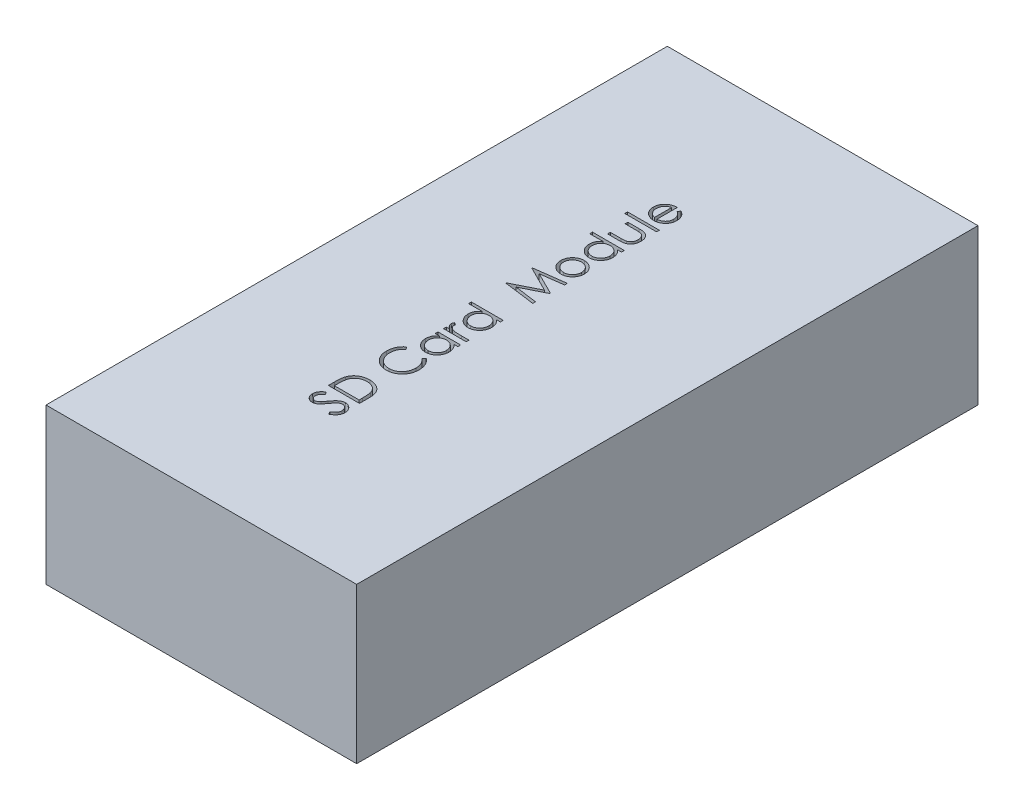
from build123d import *

# Parameters (mm, degrees)
SKETCH1_W           = 20
SKETCH1_H           = 40
BOSS_EXTRUDE1_DEPTH = 10
SKETCH2_W           = 2.051282051
SKETCH2_H           = 0.179487179
CUT_EXTRUDE1_DEPTH  = 2


with BuildPart() as part:
    # Sketch1 → Boss-Extrude1 (new body)
    with BuildSketch(Plane(origin=(0, 0, 0), x_dir=(1, 0, 0), z_dir=(0, 1, 0))):
        Rectangle(SKETCH1_W, SKETCH1_H)
    extrude(amount=BOSS_EXTRUDE1_DEPTH)

    # Sketch2 → Cut-Extrude1 (cut)
    # profile 1 of 12: a face of its own
    with BuildSketch(Plane(origin=(0, 10, 0), x_dir=(1, 0, 0), z_dir=(0, 1, 0))):
        with BuildLine():
            Line((-0.385817308, -11.41025641), (-0.487179487, -11.241185897))
            add(Edge.make_bspline(
                [(-0.487179487, -11.241185897), (-0.460856981, -11.22546119), (-0.410424076, -11.195333259), (-0.342276625, -11.145075339), (-0.284355392, -11.09299939), (-0.236997331, -11.038719771), (-0.199712253, -10.9825678), (-0.173310977, -10.924176913), (-0.156844706, -10.863743878), (-0.154844656, -10.82261598), (-0.153846154, -10.802083333)],
                knots=[0, 0, 0, 0, 1.272034388, 2.437168799, 3.508375237, 4.49857839, 5.41946034, 6.295179144, 7.148887113, 8, 8, 8, 8], degree=3))
            add(Edge.make_bspline(
                [(-0.153846154, -10.802083333), (-0.154346157, -10.784551534), (-0.155337415, -10.749794702), (-0.164477301, -10.69852676), (-0.179430136, -10.648984468), (-0.199700323, -10.601660309), (-0.22461679, -10.557808062), (-0.253997981, -10.51873726), (-0.287946895, -10.48574611), (-0.325205885, -10.458396047), (-0.365160019, -10.437232767), (-0.406327078, -10.421237355), (-0.449271907, -10.412279063), (-0.478193329, -10.410934793), (-0.492788462, -10.41025641)],
                knots=[0, 0, 0, 0, 1.09553864, 2.171907928, 3.244545276, 4.325730702, 5.384330216, 6.391480148, 7.371786628, 8.333890167, 9.27165687, 10.191402356, 11.087295184, 12, 12, 12, 12], degree=3))
            add(Edge.make_bspline(
                [(-0.492788462, -10.41025641), (-0.509445934, -10.411080779), (-0.543179131, -10.412750216), (-0.593033655, -10.427463076), (-0.642583519, -10.449928997), (-0.673239075, -10.471044437), (-0.689102564, -10.481971154)],
                knots=[0, 0, 0, 0, 0.938992559, 1.901562324, 2.914110574, 4, 4, 4, 4], degree=3))
            add(Edge.make_bspline(
                [(-0.689102564, -10.481971154), (-0.70055934, -10.490924478), (-0.724611408, -10.509720861), (-0.760383255, -10.54206249), (-0.797356653, -10.579819979), (-0.836343296, -10.622476558), (-0.877019368, -10.67010378), (-0.919702283, -10.722720072), (-0.963519813, -10.780774483), (-0.992869081, -10.821522679), (-1.008012821, -10.842548077)],
                knots=[0, 0, 0, 0, 0.72225051, 1.516274602, 2.393638633, 3.3469932, 4.386926276, 5.505032946, 6.712638081, 8, 8, 8, 8], degree=3))
            add(Edge.make_bspline(
                [(-1.008012821, -10.842548077), (-1.023000585, -10.86359036), (-1.051656049, -10.903821604), (-1.094184211, -10.960083651), (-1.133066422, -11.010394773), (-1.168668715, -11.054531354), (-1.200995918, -11.092473981), (-1.229737597, -11.124521644), (-1.255671061, -11.149857962), (-1.272494685, -11.163946866), (-1.280048077, -11.170272436)],
                knots=[0, 0, 0, 0, 1.452282411, 2.77665338, 3.964542531, 5.026858415, 5.96415736, 6.766646006, 7.446254459, 8, 8, 8, 8], degree=3))
            add(Edge.make_bspline(
                [(-1.280048077, -11.170272436), (-1.291820682, -11.179112408), (-1.314973091, -11.196497401), (-1.351150397, -11.219470521), (-1.388113303, -11.238843816), (-1.425995771, -11.254435696), (-1.464513093, -11.267044259), (-1.50395444, -11.275810445), (-1.544052062, -11.281213737), (-1.571030271, -11.281771881), (-1.584535256, -11.282051282)],
                knots=[0, 0, 0, 0, 1.068019517, 2.100403715, 3.106014851, 4.09224787, 5.069873182, 6.043214339, 7.020455327, 8, 8, 8, 8], degree=3))
            add(Edge.make_bspline(
                [(-1.584535256, -11.282051282), (-1.605695169, -11.281305482), (-1.647562716, -11.279829821), (-1.70872259, -11.267349044), (-1.767117065, -11.247652043), (-1.822154568, -11.220048221), (-1.872452268, -11.184497811), (-1.918462891, -11.143178253), (-1.957670635, -11.09442005), (-1.991393415, -11.040441094), (-2.018061545, -10.981667323), (-2.037388031, -10.919791323), (-2.048867721, -10.855257878), (-2.050469367, -10.811477321), (-2.051282051, -10.789262821)],
                knots=[0, 0, 0, 0, 1.005248779, 1.989011071, 2.95484373, 3.928844559, 4.904706341, 5.875556129, 6.859318422, 7.868909462, 8.894684146, 9.918924798, 10.944050749, 12, 12, 12, 12], degree=3))
            add(Edge.make_bspline(
                [(-2.051282051, -10.789262821), (-2.050480202, -10.765690947), (-2.048885581, -10.718814014), (-2.034675706, -10.649970746), (-2.012060047, -10.583417824), (-1.985525953, -10.530117687), (-1.95919342, -10.48831403), (-1.9351565, -10.456465403), (-1.907541477, -10.424016155), (-1.875766183, -10.391315017), (-1.840466155, -10.358039161), (-1.801342577, -10.324341865), (-1.758748016, -10.289907778), (-1.728332715, -10.267762817), (-1.712740385, -10.256410256)],
                knots=[0, 0, 0, 0, 1.286507425, 2.558452658, 3.822738219, 5.118007103, 5.800084425, 6.519418873, 7.295692132, 8.12638276, 9.008892966, 9.945018126, 10.946518512, 12, 12, 12, 12], degree=3))
            Line((-1.712740385, -10.256410256), (-1.58974359, -10.418669872))
            add(Edge.make_bspline(
                [(-1.58974359, -10.418669872), (-1.602366429, -10.428466833), (-1.626675066, -10.44733349), (-1.660706101, -10.475988413), (-1.69183416, -10.502955442), (-1.718800194, -10.529727804), (-1.743623527, -10.554241892), (-1.764499145, -10.57845685), (-1.78208662, -10.601438219), (-1.800889972, -10.630336655), (-1.818965297, -10.666944353), (-1.834842345, -10.712515046), (-1.844261458, -10.760299234), (-1.845517822, -10.792827647), (-1.846153846, -10.809294872)],
                knots=[0, 0, 0, 0, 1.181392137, 2.275085037, 3.289537922, 4.225335853, 5.084247276, 5.86831218, 6.587234301, 7.222706459, 8.415108401, 9.595592188, 10.782789524, 12, 12, 12, 12], degree=3))
            add(Edge.make_bspline(
                [(-1.846153846, -10.809294872), (-1.845472784, -10.829960617), (-1.844159419, -10.869812561), (-1.829438063, -10.926258842), (-1.807055232, -10.977356812), (-1.774779424, -11.021155815), (-1.736300444, -11.057319972), (-1.692417877, -11.08380437), (-1.643951289, -11.099638926), (-1.610158727, -11.101577048), (-1.592948718, -11.102564103)],
                knots=[0, 0, 0, 0, 1.144248881, 2.206576175, 3.214949548, 4.222996039, 5.203671638, 6.127710127, 7.046472867, 8, 8, 8, 8], degree=3))
            add(Edge.make_bspline(
                [(-1.592948718, -11.102564103), (-1.582236044, -11.102326625), (-1.560661466, -11.101848363), (-1.528938546, -11.095736945), (-1.497382892, -11.087473805), (-1.466105561, -11.074806016), (-1.434398301, -11.05716507), (-1.401813271, -11.034023927), (-1.368069803, -11.004872014), (-1.346122678, -10.982542511), (-1.334535256, -10.970753205)],
                knots=[0, 0, 0, 0, 0.858259122, 1.72847414, 2.583651051, 3.473048463, 4.427392529, 5.488649985, 6.674082839, 8, 8, 8, 8], degree=3))
            add(Edge.make_bspline(
                [(-1.334535256, -10.970753205), (-1.330628385, -10.966375278), (-1.321346551, -10.955974325), (-1.306150962, -10.936959511), (-1.287406521, -10.91184934), (-1.264213769, -10.881299511), (-1.237310076, -10.844746733), (-1.207039441, -10.802186987), (-1.172419178, -10.754094682), (-1.148214869, -10.719967873), (-1.135416667, -10.701923077)],
                knots=[0, 0, 0, 0, 0.420754252, 0.999615792, 1.744751191, 2.668019286, 3.750313428, 4.999500688, 6.413464383, 8, 8, 8, 8], degree=3))
            add(Edge.make_bspline(
                [(-1.135416667, -10.701923077), (-1.119621593, -10.680216856), (-1.089036622, -10.638185768), (-1.043084955, -10.578381229), (-0.998142857, -10.524156905), (-0.954500246, -10.475318407), (-0.912478411, -10.43139668), (-0.87160437, -10.392834482), (-0.83214617, -10.359456846), (-0.781902311, -10.323032702), (-0.719623207, -10.286255114), (-0.643285165, -10.254721355), (-0.566728056, -10.234660118), (-0.515338968, -10.232054716), (-0.489983974, -10.230769231)],
                knots=[0, 0, 0, 0, 1.163604038, 2.253157948, 3.268574773, 4.215621239, 5.091738613, 5.902582348, 6.650434646, 7.330118262, 8.591011492, 9.77460283, 10.902005569, 12, 12, 12, 12], degree=3))
            add(Edge.make_bspline(
                [(-0.489983974, -10.230769231), (-0.47205367, -10.231145121), (-0.436541256, -10.231889602), (-0.384392735, -10.24043313), (-0.333756796, -10.252979351), (-0.285309419, -10.271736996), (-0.238273251, -10.295004727), (-0.193534363, -10.324105959), (-0.150223574, -10.358014402), (-0.109555112, -10.396891472), (-0.072175555, -10.439410141), (-0.039062123, -10.484511199), (-0.0108161, -10.531723831), (0.011679088, -10.581559317), (0.029391365, -10.633482294), (0.042188861, -10.687663983), (0.050051941, -10.744159269), (0.050867437, -10.782559761), (0.051282051, -10.802083333)],
                knots=[0, 0, 0, 0, 0.983922938, 1.948738757, 2.895227473, 3.844781104, 4.796118043, 5.772795661, 6.770647148, 7.813532943, 8.8582745, 9.876489951, 10.882905461, 11.874265028, 12.874055871, 13.891769171, 14.928133632, 16, 16, 16, 16], degree=3))
            add(Edge.make_bspline(
                [(0.051282051, -10.802083333), (0.050989947, -10.817189244), (0.050409419, -10.847210821), (0.045277259, -10.891616239), (0.038016055, -10.935124574), (0.026488022, -10.977189886), (0.012501152, -11.018354091), (-0.004720655, -11.058438339), (-0.025359425, -11.097461365), (-0.048955162, -11.135644506), (-0.076422255, -11.172880415), (-0.108385085, -11.208860215), (-0.144028609, -11.244530435), (-0.183903457, -11.279638042), (-0.228448117, -11.313417099), (-0.276999076, -11.346678532), (-0.329700714, -11.379260244), (-0.366762397, -11.399731374), (-0.385817308, -11.41025641)],
                knots=[0, 0, 0, 0, 0.915313873, 1.819100311, 2.706792138, 3.586475221, 4.459428225, 5.3405999, 6.2277379, 7.133009489, 8.059106158, 9.028520402, 10.047404263, 11.114294124, 12.246039232, 13.433834781, 14.680630578, 16, 16, 16, 16], degree=3))
        make_face()
    # profile 2 of 12: a face of its own
    with BuildSketch(Plane(origin=(0, 10, 0), x_dir=(1, 0, 0), z_dir=(0, 1, 0))):
        with BuildLine():
            Line((0, -9.820512821), (-2, -9.820512821))
            Line((-2, -9.820512821), (-2, -9.416666667))
            add(Edge.make_bspline(
                [(-2, -9.416666667), (-1.999747103, -9.381541531), (-1.999258507, -9.31367995), (-1.996160569, -9.215615695), (-1.990680303, -9.124882116), (-1.982697717, -9.041777625), (-1.972895983, -8.966074076), (-1.960610038, -8.897983442), (-1.946102512, -8.837153646), (-1.933733683, -8.799742537), (-1.927884615, -8.782051282)],
                knots=[0, 0, 0, 0, 1.314313732, 2.53924729, 3.670748893, 4.714932338, 5.66265055, 6.526160246, 7.303039223, 8, 8, 8, 8], degree=3))
            add(Edge.make_bspline(
                [(-1.927884615, -8.782051282), (-1.919069815, -8.758909347), (-1.901640105, -8.713150259), (-1.868710928, -8.648033586), (-1.831553985, -8.586524618), (-1.789314193, -8.529113761), (-1.742543133, -8.475656964), (-1.691574936, -8.425547508), (-1.635277366, -8.380020843), (-1.574652486, -8.33836789), (-1.510477072, -8.300802212), (-1.442856226, -8.268151925), (-1.372138034, -8.241035177), (-1.298517891, -8.218524811), (-1.221834263, -8.200783965), (-1.141997764, -8.188680008), (-1.059323942, -8.180696584), (-1.003224249, -8.179894269), (-0.974759615, -8.179487179)],
                knots=[0, 0, 0, 0, 0.984741985, 1.947153288, 2.898543998, 3.841229145, 4.778974371, 5.722123648, 6.681464302, 7.655713756, 8.646344578, 9.637374342, 10.639946623, 11.656849581, 12.698333139, 13.76849723, 14.867749466, 16, 16, 16, 16], degree=3))
            add(Edge.make_bspline(
                [(-0.974759615, -8.179487179), (-0.950038908, -8.17984659), (-0.901324172, -8.180554845), (-0.829529371, -8.18691445), (-0.759864485, -8.196158076), (-0.692661185, -8.210468994), (-0.62733093, -8.22784205), (-0.564569078, -8.250106577), (-0.503803275, -8.27561515), (-0.445842752, -8.305348466), (-0.390965868, -8.338035097), (-0.339195829, -8.372894408), (-0.291681428, -8.410716981), (-0.247177572, -8.450383383), (-0.206873133, -8.492850164), (-0.170033415, -8.537600297), (-0.137275193, -8.584807692), (-0.108083705, -8.634764578), (-0.081978565, -8.68813814), (-0.060203746, -8.746607248), (-0.041344529, -8.809894945), (-0.026342022, -8.878362145), (-0.014242392, -8.951764646), (-0.006186412, -9.030306069), (-0.000722936, -9.113837981), (-0.000245658, -9.171197759), (0, -9.200721154)],
                knots=[0, 0, 0, 0, 1.106010661, 2.179509527, 3.223302912, 4.248870533, 5.252098245, 6.246278179, 7.226402005, 8.199283979, 9.158616973, 10.083547221, 10.989831858, 11.874256832, 12.749262829, 13.607058236, 14.46581075, 15.317568432, 16.194266721, 17.121067875, 18.106207572, 19.147242834, 20.255495536, 21.43354536, 22.679031616, 24, 24, 24, 24], degree=3))
            Line((0, -9.200721154), (0, -9.820512821))
        make_face()
        with BuildLine():
            Line((-0.205128205, -9.641025641), (-0.205128205, -9.411458333))
            add(Edge.make_bspline(
                [(-0.205128205, -9.411458333), (-0.205269974, -9.378470693), (-0.205542649, -9.31502338), (-0.207935336, -9.223790238), (-0.211845015, -9.140430583), (-0.217316488, -9.064932578), (-0.224555697, -8.99733885), (-0.23262707, -8.937508135), (-0.242682756, -8.885636559), (-0.25179759, -8.854248309), (-0.256009615, -8.83974359)],
                knots=[0, 0, 0, 0, 1.375205317, 2.645023457, 3.804390687, 4.853969522, 5.800190428, 6.637939096, 7.370582563, 8, 8, 8, 8], degree=3))
            add(Edge.make_bspline(
                [(-0.256009615, -8.83974359), (-0.262439076, -8.821487381), (-0.27514443, -8.785411013), (-0.298320254, -8.733478991), (-0.325772801, -8.685046316), (-0.35628862, -8.639269529), (-0.390942606, -8.596795773), (-0.428986447, -8.557130034), (-0.470593957, -8.520320874), (-0.515697668, -8.486935253), (-0.563808484, -8.456695563), (-0.615011493, -8.430736058), (-0.668586858, -8.40812873), (-0.724968301, -8.390227821), (-0.783742578, -8.376113738), (-0.845214457, -8.366220555), (-0.909329543, -8.360078717), (-0.952977429, -8.359346492), (-0.975160256, -8.358974359)],
                knots=[0, 0, 0, 0, 0.998590647, 1.973329978, 2.929871262, 3.868367705, 4.809062953, 5.754642869, 6.701828697, 7.672172887, 8.647399344, 9.630604387, 10.631475358, 11.644913558, 12.679592956, 13.747988925, 14.855477812, 16, 16, 16, 16], degree=3))
            add(Edge.make_bspline(
                [(-0.975160256, -8.358974359), (-0.998550817, -8.359267666), (-1.044501779, -8.35984387), (-1.111925034, -8.367086333), (-1.17677112, -8.377670079), (-1.239044374, -8.392975043), (-1.29886629, -8.412478402), (-1.35590601, -8.436818198), (-1.410765935, -8.464627694), (-1.462179858, -8.497715315), (-1.510804492, -8.533952797), (-1.555350158, -8.574168728), (-1.595918329, -8.617724179), (-1.633140794, -8.664144093), (-1.665520037, -8.714736721), (-1.694483855, -8.768310259), (-1.719064364, -8.825650642), (-1.732138, -8.865543611), (-1.738782051, -8.885817308)],
                knots=[0, 0, 0, 0, 1.122418816, 2.205001699, 3.251619955, 4.274784885, 5.280384055, 6.268708349, 7.249350384, 8.229342522, 9.199999885, 10.157847722, 11.105861043, 12.055065948, 13.010012805, 13.98527497, 14.976112212, 16, 16, 16, 16], degree=3))
            add(Edge.make_bspline(
                [(-1.738782051, -8.885817308), (-1.74342001, -8.902589391), (-1.753281583, -8.938251443), (-1.764038939, -8.996445422), (-1.773527224, -9.061939793), (-1.781560389, -9.135025337), (-1.787324573, -9.215618742), (-1.791651038, -9.303781992), (-1.794569114, -9.399553195), (-1.794768375, -9.465943214), (-1.794871795, -9.500400641)],
                knots=[0, 0, 0, 0, 0.674548936, 1.434276114, 2.292660221, 3.240891867, 4.284742987, 5.42552168, 6.663806718, 8, 8, 8, 8], degree=3))
            Line((-1.794871795, -9.500400641), (-1.794871795, -9.641025641))
            Line((-1.794871795, -9.641025641), (-0.205128205, -9.641025641))
        make_face(mode=Mode.SUBTRACT)
    # profile 3 of 12: a face of its own
    with BuildSketch(Plane(origin=(0, 10, 0), x_dir=(1, 0, 0), z_dir=(0, 1, 0))):
        with BuildLine():
            Line((-1.633012821, -5.153846154), (-1.512820513, -5.310897436))
            add(Edge.make_bspline(
                [(-1.512820513, -5.310897436), (-1.526172319, -5.322100916), (-1.55269592, -5.344356828), (-1.589943969, -5.380160398), (-1.624828696, -5.417481937), (-1.65757424, -5.456269515), (-1.686864489, -5.497420768), (-1.714980593, -5.539367716), (-1.73959721, -5.583634478), (-1.769669486, -5.644536114), (-1.800365682, -5.72451649), (-1.826767059, -5.824850686), (-1.843415161, -5.929734011), (-1.845230494, -6.001272761), (-1.846153846, -6.037660256)],
                knots=[0, 0, 0, 0, 0.75789156, 1.505565099, 2.245254514, 2.979266606, 3.711207489, 4.440978832, 5.174393176, 5.91211879, 7.394186119, 8.890401545, 10.418332761, 12, 12, 12, 12], degree=3))
            add(Edge.make_bspline(
                [(-1.846153846, -6.037660256), (-1.84592301, -6.057707856), (-1.845463481, -6.097616995), (-1.839401124, -6.156844694), (-1.830880433, -6.214966437), (-1.818237391, -6.271944418), (-1.802253037, -6.327706109), (-1.783152799, -6.382616051), (-1.759521469, -6.43587926), (-1.733402437, -6.488232504), (-1.703901136, -6.538392182), (-1.67172173, -6.585851741), (-1.637226373, -6.630440861), (-1.600278221, -6.672184646), (-1.561071448, -6.711163213), (-1.519166808, -6.746886072), (-1.475012276, -6.779830509), (-1.428571182, -6.809808768), (-1.380276055, -6.836796162), (-1.329851157, -6.859488364), (-1.278159866, -6.879307579), (-1.224835727, -6.895237086), (-1.170233159, -6.90774762), (-1.114125959, -6.916396828), (-1.056620504, -6.922388926), (-1.017643821, -6.922846349), (-0.997996795, -6.923076923)],
                knots=[0, 0, 0, 0, 1.054877232, 2.099964208, 3.13098259, 4.145888998, 5.169474743, 6.183358035, 7.203388855, 8.234598956, 9.261847606, 10.264062591, 11.251197969, 12.227332808, 13.196685059, 14.158975844, 15.123498106, 16.094582253, 17.066912473, 18.032714859, 19.002806091, 19.979168736, 20.95977404, 21.949109834, 22.966205168, 24, 24, 24, 24], degree=3))
            add(Edge.make_bspline(
                [(-0.997996795, -6.923076923), (-0.9684367, -6.922354193), (-0.910399373, -6.920935208), (-0.825378242, -6.908360161), (-0.743849751, -6.889097652), (-0.666365924, -6.860701057), (-0.592280839, -6.824987833), (-0.52249293, -6.780427578), (-0.455979782, -6.728623667), (-0.394352306, -6.669044658), (-0.338059544, -6.603668177), (-0.288487573, -6.533526972), (-0.247164838, -6.458792972), (-0.212778568, -6.380292073), (-0.186346157, -6.297419999), (-0.167738085, -6.210325829), (-0.155599696, -6.119198973), (-0.154437589, -6.056930745), (-0.153846154, -6.025240385)],
                knots=[0, 0, 0, 0, 1.029159485, 2.020618137, 2.987588728, 3.942669054, 4.889339625, 5.846988364, 6.821327795, 7.821533711, 8.827683044, 9.822769455, 10.807800696, 11.797391277, 12.803701919, 13.832062008, 14.896664671, 16, 16, 16, 16], degree=3))
            add(Edge.make_bspline(
                [(-0.153846154, -6.025240385), (-0.154811171, -5.990324562), (-0.156710555, -5.921601872), (-0.172801555, -5.820820142), (-0.198891793, -5.724342562), (-0.235404892, -5.632163941), (-0.282870771, -5.544544143), (-0.340412415, -5.461346052), (-0.408577176, -5.38249944), (-0.460624678, -5.335087279), (-0.487179487, -5.310897436)],
                knots=[0, 0, 0, 0, 1.028121516, 2.023589091, 2.998037872, 3.967518031, 4.937445131, 5.927275754, 6.942489185, 8, 8, 8, 8], degree=3))
            Line((-0.487179487, -5.310897436), (-0.368189103, -5.153846154))
            add(Edge.make_bspline(
                [(-0.368189103, -5.153846154), (-0.35188198, -5.166485517), (-0.319345845, -5.191703701), (-0.273467927, -5.232530281), (-0.230354032, -5.275570433), (-0.190219472, -5.320934789), (-0.152898122, -5.368703305), (-0.118369709, -5.418871599), (-0.086817476, -5.471396847), (-0.057835201, -5.525861847), (-0.03231729, -5.582392102), (-0.009704694, -5.640489953), (0.009016038, -5.700511621), (0.024851677, -5.761951857), (0.0361432, -5.825365554), (0.045134885, -5.890015574), (0.050469418, -5.956507019), (0.051008744, -6.001326042), (0.051282051, -6.024038462)],
                knots=[0, 0, 0, 0, 0.986911346, 1.969095443, 2.935967484, 3.900112155, 4.865124501, 5.834589912, 6.812044781, 7.795288262, 8.784678562, 9.777857908, 10.776141921, 11.791195789, 12.811324908, 13.855933174, 14.913475973, 16, 16, 16, 16], degree=3))
            add(Edge.make_bspline(
                [(0.051282051, -6.024038462), (0.051132341, -6.045549128), (0.050836308, -6.088083808), (0.046040784, -6.150883095), (0.039498077, -6.212019998), (0.029646574, -6.271319785), (0.018021237, -6.329106056), (0.002437661, -6.384854962), (-0.015019005, -6.439115082), (-0.035536141, -6.491668419), (-0.058688245, -6.542559676), (-0.08485485, -6.591624711), (-0.113815916, -6.638840958), (-0.144933064, -6.684672628), (-0.179205808, -6.728442675), (-0.216158171, -6.770530404), (-0.255665606, -6.811171819), (-0.284154093, -6.836316211), (-0.298477564, -6.848958333)],
                knots=[0, 0, 0, 0, 1.114604814, 2.203992996, 3.262667896, 4.300477797, 5.318619304, 6.316056647, 7.298880507, 8.271930387, 9.238335007, 10.195173496, 11.151986948, 12.108099108, 13.064862484, 14.031167946, 15.010108607, 16, 16, 16, 16], degree=3))
            add(Edge.make_bspline(
                [(-0.298477564, -6.848958333), (-0.323358757, -6.869205952), (-0.372820755, -6.909456742), (-0.452976615, -6.960976578), (-0.536591603, -7.004930243), (-0.62415003, -7.04086511), (-0.715685935, -7.06846728), (-0.811052064, -7.0878734), (-0.910057774, -7.100396139), (-0.977392133, -7.101833489), (-1.01161859, -7.102564103)],
                knots=[0, 0, 0, 0, 0.994611881, 1.977215934, 2.950189954, 3.921972279, 4.908960509, 5.911694611, 6.938501887, 8, 8, 8, 8], degree=3))
            add(Edge.make_bspline(
                [(-1.01161859, -7.102564103), (-1.047593135, -7.101675421), (-1.118370806, -7.099926994), (-1.222241636, -7.085072254), (-1.321756721, -7.061175799), (-1.41673029, -7.02723472), (-1.507661878, -6.98420309), (-1.593856853, -6.931045025), (-1.675866452, -6.868378087), (-1.75244631, -6.796693763), (-1.822468797, -6.718083857), (-1.884072342, -6.633901677), (-1.935339494, -6.544311993), (-1.978194444, -6.450301792), (-2.011134138, -6.351167117), (-2.034193101, -6.247119478), (-2.048545739, -6.138354383), (-2.050360144, -6.064147283), (-2.051282051, -6.026442308)],
                knots=[0, 0, 0, 0, 1.032925535, 2.032216505, 3.007276963, 3.968222605, 4.92396291, 5.891752235, 6.871517503, 7.883894988, 8.900124299, 9.891468569, 10.874487609, 11.85992873, 12.854644235, 13.869047385, 14.917252991, 16, 16, 16, 16], degree=3))
            add(Edge.make_bspline(
                [(-2.051282051, -6.026442308), (-2.051006304, -6.003462685), (-2.05046049, -5.957976836), (-2.045146168, -5.890688513), (-2.036268482, -5.825182629), (-2.024248677, -5.76139029), (-2.009112159, -5.699127068), (-1.990247208, -5.638509449), (-1.967787158, -5.579685868), (-1.942138823, -5.522675436), (-1.913297416, -5.467863005), (-1.881603132, -5.415282985), (-1.847216112, -5.365144998), (-1.809784311, -5.31770964), (-1.769618223, -5.272918875), (-1.727188337, -5.230108273), (-1.681405869, -5.190524011), (-1.649173365, -5.166094486), (-1.633012821, -5.153846154)],
                knots=[0, 0, 0, 0, 1.096622143, 2.170653093, 3.219033441, 4.250379162, 5.267604342, 6.275621678, 7.278284436, 8.271072515, 9.257558938, 10.232633088, 11.19973724, 12.157384997, 13.114417402, 14.069920322, 15.032307892, 16, 16, 16, 16], degree=3))
        make_face()
    # profile 4 of 12: a face of its own
    with BuildSketch(Plane(origin=(0, 10, 0), x_dir=(1, 0, 0), z_dir=(0, 1, 0))):
        with BuildLine():
            Line((-1.461538462, -3.307692308), (0, -3.307692308))
            Line((0, -3.307692308), (0, -3.487179487))
            Line((0, -3.487179487), (-0.252804487, -3.487179487))
            add(Edge.make_bspline(
                [(-0.252804487, -3.487179487), (-0.229962419, -3.507450393), (-0.185319545, -3.547068149), (-0.126461954, -3.612613758), (-0.078803458, -3.682955799), (-0.039753095, -3.756329182), (-0.010538305, -3.83345262), (0.010263999, -3.913923011), (0.023629123, -3.997817237), (0.024964375, -4.055104021), (0.025641026, -4.084134615)],
                knots=[0, 0, 0, 0, 1.074325654, 2.099677833, 3.090439787, 4.057542011, 5.018572219, 5.985274637, 6.979019747, 8, 8, 8, 8], degree=3))
            add(Edge.make_bspline(
                [(0.025641026, -4.084134615), (0.024940241, -4.109944875), (0.023558264, -4.160843849), (0.012836948, -4.235717607), (-0.00438055, -4.307770321), (-0.028323916, -4.377070077), (-0.060084385, -4.443168446), (-0.098107956, -4.506631358), (-0.14338843, -4.567130039), (-0.195153018, -4.623742347), (-0.251378724, -4.675874919), (-0.311347608, -4.721624218), (-0.374800354, -4.759768835), (-0.440933584, -4.791666024), (-0.510256395, -4.816235363), (-0.582529063, -4.833363154), (-0.657666133, -4.844071981), (-0.708831575, -4.845453387), (-0.734775641, -4.846153846)],
                knots=[0, 0, 0, 0, 1.033919861, 2.038935746, 3.024066025, 3.998881131, 4.97069526, 5.957263378, 6.95902576, 7.993208707, 9.027059324, 10.027763471, 11.009749337, 11.988697705, 12.965288445, 13.950418724, 14.960734635, 16, 16, 16, 16], degree=3))
            add(Edge.make_bspline(
                [(-0.734775641, -4.846153846), (-0.760183472, -4.845437863), (-0.810413382, -4.844022401), (-0.884286924, -4.833477704), (-0.955440216, -4.815745699), (-1.023644183, -4.790861215), (-1.088981355, -4.758951527), (-1.15149794, -4.720135477), (-1.211366168, -4.674410263), (-1.267178297, -4.621694602), (-1.318732934, -4.564589019), (-1.363538103, -4.503498315), (-1.402233445, -4.439942154), (-1.432892574, -4.37293472), (-1.457697777, -4.303467803), (-1.474859473, -4.230922977), (-1.484972228, -4.155602075), (-1.486436665, -4.104464651), (-1.487179487, -4.078525641)],
                knots=[0, 0, 0, 0, 1.020392517, 2.01726096, 2.990465484, 3.961182959, 4.928053699, 5.906110375, 6.912531644, 7.948652711, 8.985773172, 9.998621852, 10.987621588, 11.969261332, 12.953316658, 13.946091881, 14.958173133, 16, 16, 16, 16], degree=3))
            add(Edge.make_bspline(
                [(-1.487179487, -4.078525641), (-1.486357, -4.048697715), (-1.484744141, -3.99020656), (-1.471349807, -3.90463971), (-1.448652067, -3.823729139), (-1.417990195, -3.746615902), (-1.376392304, -3.674361445), (-1.325386481, -3.606066305), (-1.262863963, -3.543183468), (-1.21543894, -3.506170412), (-1.191105769, -3.487179487)],
                knots=[0, 0, 0, 0, 1.039007978, 2.037445607, 3.008437381, 3.96246474, 4.921201921, 5.904967172, 6.925065498, 8, 8, 8, 8], degree=3))
            Line((-1.191105769, -3.487179487), (-1.461538462, -3.487179487))
            Line((-1.461538462, -3.487179487), (-1.461538462, -3.307692308))
        make_face()
        with BuildLine():
            add(Edge.make_bspline(
                [(-1.307692308, -4.076121795), (-1.306758001, -4.102357995), (-1.30491383, -4.15414408), (-1.290540529, -4.23017739), (-1.266563058, -4.302897228), (-1.233962877, -4.372190515), (-1.192192741, -4.436124962), (-1.142979808, -4.494267497), (-1.085493382, -4.54482536), (-1.021790739, -4.588304999), (-0.953120856, -4.623209426), (-0.88136033, -4.647909008), (-0.807751066, -4.664168706), (-0.757830388, -4.665831845), (-0.732772436, -4.666666667)],
                knots=[0, 0, 0, 0, 1.031130969, 2.035288524, 3.029955243, 4.035265425, 5.037320146, 6.024362013, 7.021230137, 8.037832003, 9.049975902, 10.039737725, 11.016035826, 12, 12, 12, 12], degree=3))
            add(Edge.make_bspline(
                [(-0.732772436, -4.666666667), (-0.707865376, -4.665596713), (-0.658148885, -4.663460999), (-0.584545939, -4.648265002), (-0.512946494, -4.622436703), (-0.443724789, -4.587579474), (-0.3793997, -4.543588113), (-0.320880752, -4.493078334), (-0.270898021, -4.43465606), (-0.229027187, -4.370149998), (-0.195225603, -4.301224743), (-0.171700919, -4.228749894), (-0.156513999, -4.154077659), (-0.15473996, -4.103304956), (-0.153846154, -4.077724359)],
                knots=[0, 0, 0, 0, 0.979154007, 1.954470061, 2.941101473, 3.965068436, 4.993389179, 5.998216918, 6.996159742, 8.005560442, 9.015493761, 10.005250788, 10.994993882, 12, 12, 12, 12], degree=3))
            add(Edge.make_bspline(
                [(-0.153846154, -4.077724359), (-0.154805663, -4.051758467), (-0.156714031, -4.000114884), (-0.171006012, -3.923771097), (-0.195514187, -3.849936833), (-0.228450639, -3.779115758), (-0.269473838, -3.713204459), (-0.317500922, -3.654248673), (-0.372971978, -3.60380746), (-0.434643565, -3.56181146), (-0.501822981, -3.52850658), (-0.573274006, -3.504154477), (-0.649141668, -3.489916449), (-0.701061842, -3.488104422), (-0.727564103, -3.487179487)],
                knots=[0, 0, 0, 0, 1.01787422, 2.024450869, 3.03297362, 4.061474925, 5.080076323, 6.069755756, 7.033548292, 8.009625779, 8.9862229, 9.964937832, 10.961217871, 12, 12, 12, 12], degree=3))
            add(Edge.make_bspline(
                [(-0.727564103, -3.487179487), (-0.747757149, -3.487727862), (-0.787503453, -3.488807238), (-0.845862035, -3.497053278), (-0.901709878, -3.510170378), (-0.955105701, -3.528653904), (-1.005754281, -3.552934638), (-1.054019287, -3.582219076), (-1.099649693, -3.61702219), (-1.142017162, -3.656783731), (-1.180660855, -3.700306703), (-1.215154707, -3.746360727), (-1.243491148, -3.795491439), (-1.266943304, -3.846872603), (-1.285605675, -3.900593366), (-1.298055786, -3.957090863), (-1.306604541, -4.01576457), (-1.307325901, -4.055790887), (-1.307692308, -4.076121795)],
                knots=[0, 0, 0, 0, 1.050140795, 2.067009409, 3.05949893, 4.030605086, 5.00011959, 5.97591094, 6.962425594, 7.979863591, 8.993523472, 9.986985069, 10.967611495, 11.937549037, 12.921786183, 13.919465291, 14.943216303, 16, 16, 16, 16], degree=3))
        make_face(mode=Mode.SUBTRACT)
    # profile 5 of 12: a face of its own
    with BuildSketch(Plane(origin=(0, 10, 0), x_dir=(1, 0, 0), z_dir=(0, 1, 0))):
        with BuildLine():
            Line((-1.461538462, -2.948717949), (-1.461538462, -2.769230769))
            Line((-1.461538462, -2.769230769), (-1.246394231, -2.769230769))
            add(Edge.make_bspline(
                [(-1.246394231, -2.769230769), (-1.2664351, -2.755988528), (-1.304763108, -2.730662846), (-1.355386319, -2.688371521), (-1.397778978, -2.645514622), (-1.431132652, -2.600966804), (-1.456339885, -2.555164823), (-1.474052217, -2.508494905), (-1.485036174, -2.460842924), (-1.486464092, -2.42874266), (-1.487179487, -2.412660256)],
                knots=[0, 0, 0, 0, 1.280091057, 2.448164201, 3.510831157, 4.48793739, 5.405868014, 6.289422536, 7.142991551, 8, 8, 8, 8], degree=3))
            add(Edge.make_bspline(
                [(-1.487179487, -2.412660256), (-1.486499186, -2.40018807), (-1.485099423, -2.374525735), (-1.475264666, -2.335678541), (-1.459562939, -2.295653712), (-1.444797097, -2.269858062), (-1.437099359, -2.256410256)],
                knots=[0, 0, 0, 0, 0.901110191, 1.854092781, 2.881294221, 4, 4, 4, 4], degree=3))
            Line((-1.437099359, -2.256410256), (-1.281650641, -2.354967949))
            add(Edge.make_bspline(
                [(-1.281650641, -2.354967949), (-1.285502222, -2.363601675), (-1.292813259, -2.379990141), (-1.301465836, -2.403964178), (-1.306560645, -2.426067799), (-1.307332484, -2.440149833), (-1.307692308, -2.446714744)],
                knots=[0, 0, 0, 0, 1.180555205, 2.24091978, 3.179933427, 4, 4, 4, 4], degree=3))
            add(Edge.make_bspline(
                [(-1.307692308, -2.446714744), (-1.306739804, -2.461122344), (-1.304796974, -2.490509673), (-1.289305165, -2.533510436), (-1.264994983, -2.57561065), (-1.237312873, -2.608723926), (-1.210721786, -2.634453563), (-1.18744872, -2.652957665), (-1.161111118, -2.669565372), (-1.132726985, -2.685675289), (-1.101583961, -2.700642617), (-1.06763124, -2.714018125), (-1.031149191, -2.726526799), (-1.005782372, -2.733571107), (-0.992788462, -2.737179487)],
                knots=[0, 0, 0, 0, 1.125322384, 2.295331465, 3.535939348, 4.916963136, 5.656144286, 6.429838446, 7.238666481, 8.090384391, 8.983239461, 9.940052224, 10.944811494, 12, 12, 12, 12], degree=3))
            add(Edge.make_bspline(
                [(-0.992788462, -2.737179487), (-0.981202147, -2.739888385), (-0.955410648, -2.745918478), (-0.912337848, -2.751624988), (-0.86148149, -2.75749035), (-0.802782493, -2.761495802), (-0.736015218, -2.765279485), (-0.661467698, -2.767369748), (-0.578935039, -2.769164264), (-0.521368833, -2.769207894), (-0.491185897, -2.769230769)],
                knots=[0, 0, 0, 0, 0.566841273, 1.261806378, 2.068780918, 3.007109044, 4.065315289, 5.256255371, 6.561408263, 8, 8, 8, 8], degree=3))
            Line((-0.491185897, -2.769230769), (0, -2.769230769))
            Line((0, -2.769230769), (0, -2.948717949))
            Line((0, -2.948717949), (-1.461538462, -2.948717949))
        make_face()
    # profile 6 of 12: a face of its own
    with BuildSketch(Plane(origin=(0, 10, 0), x_dir=(1, 0, 0), z_dir=(0, 1, 0))):
        with BuildLine():
            Line((-2.051282051, -0.564102564), (0, -0.564102564))
            Line((0, -0.564102564), (0, -0.743589744))
            Line((0, -0.743589744), (-0.252804487, -0.743589744))
            add(Edge.make_bspline(
                [(-0.252804487, -0.743589744), (-0.229962419, -0.763860649), (-0.185319545, -0.803478405), (-0.126461954, -0.869024015), (-0.078803458, -0.939366055), (-0.039753095, -1.012739439), (-0.010538305, -1.089862876), (0.010263999, -1.170333268), (0.023629123, -1.254227493), (0.024964375, -1.311514277), (0.025641026, -1.340544872)],
                knots=[0, 0, 0, 0, 1.074325654, 2.099677833, 3.090439787, 4.057542011, 5.018572219, 5.985274637, 6.979019747, 8, 8, 8, 8], degree=3))
            add(Edge.make_bspline(
                [(0.025641026, -1.340544872), (0.024940241, -1.366355131), (0.023558264, -1.417254105), (0.012836948, -1.492127864), (-0.00438055, -1.564180578), (-0.028323916, -1.633480333), (-0.060084385, -1.699578702), (-0.098107956, -1.763041615), (-0.14338843, -1.823540296), (-0.195153018, -1.880152604), (-0.251378724, -1.932285175), (-0.311347608, -1.978034474), (-0.374800354, -2.016179091), (-0.440933584, -2.04807628), (-0.510256395, -2.07264562), (-0.582529063, -2.089773411), (-0.657666133, -2.100482238), (-0.708831575, -2.101863644), (-0.734775641, -2.102564103)],
                knots=[0, 0, 0, 0, 1.033919861, 2.038935746, 3.024066025, 3.998881131, 4.97069526, 5.957263378, 6.95902576, 7.993208707, 9.027059324, 10.027763471, 11.009749337, 11.988697705, 12.965288445, 13.950418724, 14.960734635, 16, 16, 16, 16], degree=3))
            add(Edge.make_bspline(
                [(-0.734775641, -2.102564103), (-0.760183472, -2.101848119), (-0.810413382, -2.100432658), (-0.884286924, -2.089887961), (-0.955440216, -2.072155956), (-1.023644183, -2.047271471), (-1.088981355, -2.015361783), (-1.15149794, -1.976545733), (-1.211366168, -1.930820519), (-1.267178297, -1.878104858), (-1.318732934, -1.820999275), (-1.363538103, -1.759908572), (-1.402233445, -1.696352411), (-1.432892574, -1.629344976), (-1.457697777, -1.559878059), (-1.474859473, -1.487333233), (-1.484972228, -1.412012331), (-1.486436665, -1.360874907), (-1.487179487, -1.334935897)],
                knots=[0, 0, 0, 0, 1.020392517, 2.01726096, 2.990465484, 3.961182959, 4.928053699, 5.906110375, 6.912531644, 7.948652711, 8.985773172, 9.998621852, 10.987621588, 11.969261332, 12.953316658, 13.946091881, 14.958173133, 16, 16, 16, 16], degree=3))
            add(Edge.make_bspline(
                [(-1.487179487, -1.334935897), (-1.48629542, -1.305094491), (-1.484560094, -1.246519126), (-1.4697153, -1.160946739), (-1.44566327, -1.07979224), (-1.411846191, -1.002882208), (-1.367460119, -0.930891066), (-1.31454749, -0.86262352), (-1.250895871, -0.799798893), (-1.203122867, -0.762611787), (-1.178685897, -0.743589744)],
                knots=[0, 0, 0, 0, 1.030935089, 2.023611011, 2.991955418, 3.950956655, 4.918431382, 5.908366361, 6.930082213, 8, 8, 8, 8], degree=3))
            Line((-1.178685897, -0.743589744), (-2.051282051, -0.743589744))
            Line((-2.051282051, -0.743589744), (-2.051282051, -0.564102564))
        make_face()
        with BuildLine():
            add(Edge.make_bspline(
                [(-1.307692308, -1.332532051), (-1.306758001, -1.358768251), (-1.30491383, -1.410554337), (-1.290540529, -1.486587646), (-1.266563058, -1.559307484), (-1.233962877, -1.628600771), (-1.192192741, -1.692535219), (-1.142979808, -1.750677754), (-1.085493382, -1.801235616), (-1.021790739, -1.844715255), (-0.953120856, -1.879619682), (-0.88136033, -1.904319265), (-0.807751066, -1.920578962), (-0.757830388, -1.922242101), (-0.732772436, -1.923076923)],
                knots=[0, 0, 0, 0, 1.031130969, 2.035288524, 3.029955243, 4.035265425, 5.037320146, 6.024362013, 7.021230137, 8.037832003, 9.049975902, 10.039737725, 11.016035826, 12, 12, 12, 12], degree=3))
            add(Edge.make_bspline(
                [(-0.732772436, -1.923076923), (-0.707865376, -1.922006969), (-0.658148885, -1.919871255), (-0.584545939, -1.904675259), (-0.512946494, -1.87884696), (-0.443724789, -1.843989731), (-0.3793997, -1.799998369), (-0.320880752, -1.749488591), (-0.270898021, -1.691066317), (-0.229027187, -1.626560254), (-0.195225603, -1.557634999), (-0.171700919, -1.48516015), (-0.156513999, -1.410487916), (-0.15473996, -1.359715213), (-0.153846154, -1.334134615)],
                knots=[0, 0, 0, 0, 0.979154007, 1.954470061, 2.941101473, 3.965068436, 4.993389179, 5.998216918, 6.996159742, 8.005560442, 9.015493761, 10.005250788, 10.994993882, 12, 12, 12, 12], degree=3))
            add(Edge.make_bspline(
                [(-0.153846154, -1.334134615), (-0.154805663, -1.308168724), (-0.156714031, -1.25652514), (-0.171006012, -1.180181353), (-0.195514187, -1.106347089), (-0.228450639, -1.035526015), (-0.269473838, -0.969614716), (-0.317500922, -0.910658929), (-0.372971978, -0.860217717), (-0.434643565, -0.818221716), (-0.501822981, -0.784916836), (-0.573274006, -0.760564733), (-0.649141668, -0.746326705), (-0.701061842, -0.744514679), (-0.727564103, -0.743589744)],
                knots=[0, 0, 0, 0, 1.01787422, 2.024450869, 3.03297362, 4.061474925, 5.080076323, 6.069755756, 7.033548292, 8.009625779, 8.9862229, 9.964937832, 10.961217871, 12, 12, 12, 12], degree=3))
            add(Edge.make_bspline(
                [(-0.727564103, -0.743589744), (-0.747757149, -0.744138119), (-0.787503453, -0.745217494), (-0.845862035, -0.753463534), (-0.901709878, -0.766580635), (-0.955105701, -0.785064161), (-1.005754281, -0.809344895), (-1.054019287, -0.838629332), (-1.099649693, -0.873432446), (-1.142017162, -0.913193987), (-1.180660855, -0.95671696), (-1.215154707, -1.002770983), (-1.243491148, -1.051901696), (-1.266943304, -1.10328286), (-1.285605675, -1.157003622), (-1.298055786, -1.213501119), (-1.306604541, -1.272174826), (-1.307325901, -1.312201143), (-1.307692308, -1.332532051)],
                knots=[0, 0, 0, 0, 1.050140795, 2.067009409, 3.05949893, 4.030605086, 5.00011959, 5.97591094, 6.962425594, 7.979863591, 8.993523472, 9.986985069, 10.967611495, 11.937549037, 12.921786183, 13.919465291, 14.943216303, 16, 16, 16, 16], degree=3))
        make_face(mode=Mode.SUBTRACT)
    # profile 7 of 12: a face of its own
    with BuildSketch(Plane(origin=(0, 10, 0), x_dir=(1, 0, 0), z_dir=(0, 1, 0))):
        Polygon((0, 1.333333333), (-2, 1.597355769), (-2, 1.622996795), (-0.358974359, 2.448717949), (-2, 3.272435897), (-2, 3.298477564), (0, 3.564102564), (0, 3.383814103), (-1.439102564, 3.192307692), (0, 2.470352564), (0, 2.429887821), (-1.442307692, 1.705128205), (0, 1.514022436), align=None)
    # profile 8 of 12: a face of its own
    with BuildSketch(Plane(origin=(0, 10, 0), x_dir=(1, 0, 0), z_dir=(0, 1, 0))):
        with BuildLine():
            add(Edge.make_bspline(
                [(-1.487179487, 4.62900641), (-1.486595549, 4.656429995), (-1.48545059, 4.710200942), (-1.473213467, 4.788948305), (-1.454500687, 4.864116954), (-1.428631223, 4.935994778), (-1.393955823, 5.003661233), (-1.352579085, 5.068101944), (-1.30356046, 5.129140235), (-1.265641564, 5.165724823), (-1.246394231, 5.184294872)],
                knots=[0, 0, 0, 0, 1.054011418, 2.066658804, 3.057071809, 4.030435133, 4.997543892, 5.974964718, 6.972108034, 8, 8, 8, 8], degree=3))
            add(Edge.make_bspline(
                [(-1.246394231, 5.184294872), (-1.227986239, 5.20028456), (-1.1915265, 5.231954491), (-1.132409007, 5.272563474), (-1.071186093, 5.307547222), (-1.007044763, 5.3355832), (-0.940544951, 5.357688928), (-0.871458088, 5.373383611), (-0.799936746, 5.382719003), (-0.751363125, 5.383977841), (-0.726762821, 5.384615385)],
                knots=[0, 0, 0, 0, 1.025258237, 2.030674902, 3.01204498, 3.988269485, 4.97094183, 5.956517959, 6.965070386, 8, 8, 8, 8], degree=3))
            add(Edge.make_bspline(
                [(-0.726762821, 5.384615385), (-0.70201993, 5.38405462), (-0.653126826, 5.382946524), (-0.581115759, 5.372464458), (-0.511290147, 5.35616098), (-0.443942322, 5.332828501), (-0.37886642, 5.302909582), (-0.316346678, 5.266400617), (-0.256259744, 5.223045407), (-0.199115837, 5.173900266), (-0.146449428, 5.119584909), (-0.10054756, 5.060661395), (-0.061220975, 4.998287662), (-0.029543023, 4.931634317), (-0.004566051, 4.861310039), (0.012976815, 4.787163143), (0.023583492, 4.709308817), (0.024945534, 4.656150405), (0.025641026, 4.62900641)],
                knots=[0, 0, 0, 0, 0.998656419, 1.973391657, 2.932242238, 3.890759089, 4.846373663, 5.82037756, 6.809684879, 7.83454468, 8.860553229, 9.859544525, 10.845671541, 11.83227036, 12.833544569, 13.85385346, 14.904124723, 16, 16, 16, 16], degree=3))
            add(Edge.make_bspline(
                [(0.025641026, 4.62900641), (0.024943199, 4.601729428), (0.023576471, 4.548306079), (0.013018024, 4.470176947), (-0.004557966, 4.395897164), (-0.029625105, 4.325480822), (-0.061221987, 4.25854091), (-0.100428667, 4.195805769), (-0.146463041, 4.136834389), (-0.199112148, 4.08250754), (-0.256260695, 4.03336548), (-0.316346431, 3.990009475), (-0.378866484, 3.953500718), (-0.443942304, 3.923581744), (-0.511290151, 3.900249279), (-0.581115758, 3.883945798), (-0.653126826, 3.873463732), (-0.702019931, 3.872355636), (-0.726762821, 3.871794872)],
                knots=[0, 0, 0, 0, 1.099876186, 2.154163076, 3.173186993, 4.173200201, 5.163417411, 6.152872554, 7.150605724, 8.17532212, 9.198891216, 10.186952605, 11.159729845, 12.11414092, 13.071450619, 14.029093627, 15.002601286, 16, 16, 16, 16], degree=3))
            add(Edge.make_bspline(
                [(-0.726762821, 3.871794872), (-0.751229964, 3.872435238), (-0.799670703, 3.873703054), (-0.871049675, 3.883051186), (-0.939925092, 3.898575099), (-1.006061762, 3.920987275), (-1.070048929, 3.94897121), (-1.13149632, 3.983602862), (-1.190355495, 4.024604668), (-1.226766883, 4.056151563), (-1.245192308, 4.072115385)],
                knots=[0, 0, 0, 0, 1.031377469, 2.041950136, 3.029500481, 4.003457997, 4.981637986, 5.969878303, 6.97268806, 8, 8, 8, 8], degree=3))
            add(Edge.make_bspline(
                [(-1.245192308, 4.072115385), (-1.264606559, 4.090657437), (-1.302788099, 4.127123645), (-1.351663827, 4.188465775), (-1.393901584, 4.252747958), (-1.427887993, 4.321162202), (-1.45465286, 4.392980978), (-1.473261726, 4.468534831), (-1.4854065, 4.547549411), (-1.486582602, 4.60158348), (-1.487179487, 4.62900641)],
                knots=[0, 0, 0, 0, 1.027980169, 2.021703884, 2.998553061, 3.971491411, 4.943284454, 5.930300938, 6.949603206, 8, 8, 8, 8], degree=3))
        make_face()
        with BuildLine():
            add(Edge.make_bspline(
                [(-1.307692308, 4.628205128), (-1.307141112, 4.608812207), (-1.306052951, 4.570526991), (-1.297776434, 4.514172943), (-1.284663575, 4.459921424), (-1.266032682, 4.407669521), (-1.241976182, 4.357593393), (-1.212428496, 4.309645277), (-1.177781293, 4.26368344), (-1.13808756, 4.220609691), (-1.094731021, 4.181070575), (-1.048521534, 4.146534725), (-1.000166932, 4.117002854), (-0.949594451, 4.092847537), (-0.896631658, 4.074322124), (-0.841590451, 4.061194664), (-0.784304626, 4.052902992), (-0.745354277, 4.051828218), (-0.725560897, 4.051282051)],
                knots=[0, 0, 0, 0, 1.02155314, 2.01673505, 2.994700672, 3.958461264, 4.934171024, 5.916582427, 6.921469794, 7.962398674, 8.998583302, 10.009097305, 10.997513862, 11.97957236, 12.956600784, 13.948243505, 14.957359924, 16, 16, 16, 16], degree=3))
            add(Edge.make_bspline(
                [(-0.725560897, 4.051282051), (-0.69998831, 4.052200236), (-0.649231507, 4.054022662), (-0.574482294, 4.068842797), (-0.502721236, 4.093634957), (-0.434369015, 4.127113402), (-0.371127714, 4.169059813), (-0.314744008, 4.218480994), (-0.266066402, 4.274846537), (-0.225677347, 4.337484537), (-0.193586058, 4.405115576), (-0.170843786, 4.476690616), (-0.156059962, 4.551342442), (-0.154590548, 4.602360002), (-0.153846154, 4.628205128)],
                knots=[0, 0, 0, 0, 1.016792936, 2.018143844, 3.017858371, 4.030088057, 5.03801393, 6.028138512, 7.003788237, 7.991172063, 8.984598303, 9.972568034, 10.972917682, 12, 12, 12, 12], degree=3))
            add(Edge.make_bspline(
                [(-0.153846154, 4.628205128), (-0.154594885, 4.654048768), (-0.156072861, 4.705063394), (-0.170769329, 4.779611495), (-0.193685707, 4.850990907), (-0.225641255, 4.9185517), (-0.266219778, 4.981161188), (-0.314469136, 5.037932114), (-0.371277051, 5.086931321), (-0.434452782, 5.128836238), (-0.502615269, 5.162862948), (-0.574495539, 5.187539063), (-0.649228134, 5.202394827), (-0.69998718, 5.204212443), (-0.725560897, 5.205128205)],
                knots=[0, 0, 0, 0, 1.02726834, 2.027799167, 3.010890988, 4.004497153, 4.992059811, 5.971914811, 6.958719428, 7.966827853, 8.981595046, 9.981490638, 10.983022906, 12, 12, 12, 12], degree=3))
            add(Edge.make_bspline(
                [(-0.725560897, 5.205128205), (-0.745354395, 5.204582226), (-0.784304977, 5.203507824), (-0.84158911, 5.195213455), (-0.896636564, 5.182095953), (-0.949576384, 5.163533922), (-1.000298142, 5.139485901), (-1.048379792, 5.109386314), (-1.094891057, 5.074991523), (-1.137947399, 5.034975375), (-1.177796766, 4.991946583), (-1.212441931, 4.945966121), (-1.241846323, 4.898089104), (-1.266238447, 4.848158455), (-1.284494074, 4.795899853), (-1.297852148, 4.741724349), (-1.306017975, 4.685610744), (-1.307130627, 4.647462719), (-1.307692308, 4.628205128)],
                knots=[0, 0, 0, 0, 1.042975879, 2.052417305, 3.044379404, 4.0217225, 5.00409729, 5.996508862, 7.007348322, 8.048612455, 9.089876587, 10.095087598, 11.077815406, 12.047498138, 13.018202342, 13.98964644, 14.985148868, 16, 16, 16, 16], degree=3))
        make_face(mode=Mode.SUBTRACT)
    # profile 9 of 12: a face of its own
    with BuildSketch(Plane(origin=(0, 10, 0), x_dir=(1, 0, 0), z_dir=(0, 1, 0))):
        with BuildLine():
            Line((-2.051282051, 7.230769231), (0, 7.230769231))
            Line((0, 7.230769231), (0, 7.051282051))
            Line((0, 7.051282051), (-0.252804487, 7.051282051))
            add(Edge.make_bspline(
                [(-0.252804487, 7.051282051), (-0.229962419, 7.031011145), (-0.185319545, 6.991393389), (-0.126461954, 6.92584778), (-0.078803458, 6.85550574), (-0.039753095, 6.782132356), (-0.010538305, 6.705008919), (0.010263999, 6.624538527), (0.023629123, 6.540644302), (0.024964375, 6.483357518), (0.025641026, 6.454326923)],
                knots=[0, 0, 0, 0, 1.074325654, 2.099677833, 3.090439787, 4.057542011, 5.018572219, 5.985274637, 6.979019747, 8, 8, 8, 8], degree=3))
            add(Edge.make_bspline(
                [(0.025641026, 6.454326923), (0.024940241, 6.428516664), (0.023558264, 6.37761769), (0.012836948, 6.302743931), (-0.00438055, 6.230691217), (-0.028323916, 6.161391461), (-0.060084385, 6.095293093), (-0.098107956, 6.03183018), (-0.14338843, 5.971331499), (-0.195153018, 5.914719191), (-0.251378724, 5.862586619), (-0.311347608, 5.816837321), (-0.374800354, 5.778692704), (-0.440933584, 5.746795515), (-0.510256395, 5.722226175), (-0.582529063, 5.705098384), (-0.657666133, 5.694389557), (-0.708831575, 5.693008151), (-0.734775641, 5.692307692)],
                knots=[0, 0, 0, 0, 1.033919861, 2.038935746, 3.024066025, 3.998881131, 4.97069526, 5.957263378, 6.95902576, 7.993208707, 9.027059324, 10.027763471, 11.009749337, 11.988697705, 12.965288445, 13.950418724, 14.960734635, 16, 16, 16, 16], degree=3))
            add(Edge.make_bspline(
                [(-0.734775641, 5.692307692), (-0.760183472, 5.693023676), (-0.810413382, 5.694439137), (-0.884286924, 5.704983834), (-0.955440216, 5.722715839), (-1.023644183, 5.747600323), (-1.088981355, 5.779510012), (-1.15149794, 5.818326062), (-1.211366168, 5.864051276), (-1.267178297, 5.916766937), (-1.318732934, 5.97387252), (-1.363538103, 6.034963223), (-1.402233445, 6.098519384), (-1.432892574, 6.165526819), (-1.457697777, 6.234993736), (-1.474859473, 6.307538562), (-1.484972228, 6.382859464), (-1.486436665, 6.433996888), (-1.487179487, 6.459935897)],
                knots=[0, 0, 0, 0, 1.020392517, 2.01726096, 2.990465484, 3.961182959, 4.928053699, 5.906110375, 6.912531644, 7.948652711, 8.985773172, 9.998621852, 10.987621588, 11.969261332, 12.953316658, 13.946091881, 14.958173133, 16, 16, 16, 16], degree=3))
            add(Edge.make_bspline(
                [(-1.487179487, 6.459935897), (-1.48629542, 6.489777304), (-1.484560094, 6.548352669), (-1.4697153, 6.633925056), (-1.44566327, 6.715079555), (-1.411846191, 6.791989587), (-1.367460119, 6.863980729), (-1.31454749, 6.932248275), (-1.250895871, 6.995072902), (-1.203122867, 7.032260008), (-1.178685897, 7.051282051)],
                knots=[0, 0, 0, 0, 1.030935089, 2.023611011, 2.991955418, 3.950956655, 4.918431382, 5.908366361, 6.930082213, 8, 8, 8, 8], degree=3))
            Line((-1.178685897, 7.051282051), (-2.051282051, 7.051282051))
            Line((-2.051282051, 7.051282051), (-2.051282051, 7.230769231))
        make_face()
        with BuildLine():
            add(Edge.make_bspline(
                [(-1.307692308, 6.462339744), (-1.306758001, 6.436103544), (-1.30491383, 6.384317458), (-1.290540529, 6.308284149), (-1.266563058, 6.23556431), (-1.233962877, 6.166271024), (-1.192192741, 6.102336576), (-1.142979808, 6.044194041), (-1.085493382, 5.993636179), (-1.021790739, 5.95015654), (-0.953120856, 5.915252112), (-0.88136033, 5.89055253), (-0.807751066, 5.874292833), (-0.757830388, 5.872629693), (-0.732772436, 5.871794872)],
                knots=[0, 0, 0, 0, 1.031130969, 2.035288524, 3.029955243, 4.035265425, 5.037320146, 6.024362013, 7.021230137, 8.037832003, 9.049975902, 10.039737725, 11.016035826, 12, 12, 12, 12], degree=3))
            add(Edge.make_bspline(
                [(-0.732772436, 5.871794872), (-0.707865376, 5.872864826), (-0.658148885, 5.875000539), (-0.584545939, 5.890196536), (-0.512946494, 5.916024835), (-0.443724789, 5.950882064), (-0.3793997, 5.994873426), (-0.320880752, 6.045383204), (-0.270898021, 6.103805478), (-0.229027187, 6.16831154), (-0.195225603, 6.237236796), (-0.171700919, 6.309711645), (-0.156513999, 6.384383879), (-0.15473996, 6.435156582), (-0.153846154, 6.460737179)],
                knots=[0, 0, 0, 0, 0.979154007, 1.954470061, 2.941101473, 3.965068436, 4.993389179, 5.998216918, 6.996159742, 8.005560442, 9.015493761, 10.005250788, 10.994993882, 12, 12, 12, 12], degree=3))
            add(Edge.make_bspline(
                [(-0.153846154, 6.460737179), (-0.154805663, 6.486703071), (-0.156714031, 6.538346654), (-0.171006012, 6.614690441), (-0.195514187, 6.688524705), (-0.228450639, 6.75934578), (-0.269473838, 6.825257079), (-0.317500922, 6.884212866), (-0.372971978, 6.934654078), (-0.434643565, 6.976650079), (-0.501822981, 7.009954959), (-0.573274006, 7.034307062), (-0.649141668, 7.04854509), (-0.701061842, 7.050357116), (-0.727564103, 7.051282051)],
                knots=[0, 0, 0, 0, 1.01787422, 2.024450869, 3.03297362, 4.061474925, 5.080076323, 6.069755756, 7.033548292, 8.009625779, 8.9862229, 9.964937832, 10.961217871, 12, 12, 12, 12], degree=3))
            add(Edge.make_bspline(
                [(-0.727564103, 7.051282051), (-0.747757149, 7.050733676), (-0.787503453, 7.049654301), (-0.845862035, 7.041408261), (-0.901709878, 7.02829116), (-0.955105701, 7.009807634), (-1.005754281, 6.9855269), (-1.054019287, 6.956242463), (-1.099649693, 6.921439349), (-1.142017162, 6.881677808), (-1.180660855, 6.838154835), (-1.215154707, 6.792100812), (-1.243491148, 6.742970099), (-1.266943304, 6.691588935), (-1.285605675, 6.637868173), (-1.298055786, 6.581370676), (-1.306604541, 6.522696969), (-1.307325901, 6.482670652), (-1.307692308, 6.462339744)],
                knots=[0, 0, 0, 0, 1.050140795, 2.067009409, 3.05949893, 4.030605086, 5.00011959, 5.97591094, 6.962425594, 7.979863591, 8.993523472, 9.986985069, 10.967611495, 11.937549037, 12.921786183, 13.919465291, 14.943216303, 16, 16, 16, 16], degree=3))
        make_face(mode=Mode.SUBTRACT)
    # profile 10 of 12: a face of its own
    with BuildSketch(Plane(origin=(0, 10, 0), x_dir=(1, 0, 0), z_dir=(0, 1, 0))):
        with BuildLine():
            Line((-1.461538462, 7.615384615), (-1.461538462, 7.794871795))
            Line((-1.461538462, 7.794871795), (-0.783653846, 7.794871795))
            add(Edge.make_bspline(
                [(-0.783653846, 7.794871795), (-0.763755132, 7.794952883), (-0.725689825, 7.795108002), (-0.670915432, 7.796159968), (-0.620963025, 7.798634307), (-0.575803747, 7.801727921), (-0.535445238, 7.805706285), (-0.500028462, 7.810439634), (-0.469151786, 7.81573016), (-0.450555582, 7.820908854), (-0.441907051, 7.823317308)],
                knots=[0, 0, 0, 0, 1.388932606, 2.656963016, 3.823490214, 4.879454478, 5.816252168, 6.653371382, 7.373723809, 8, 8, 8, 8], degree=3))
            add(Edge.make_bspline(
                [(-0.441907051, 7.823317308), (-0.431036839, 7.827180996), (-0.409522404, 7.834828048), (-0.378442973, 7.84869861), (-0.349657097, 7.86585766), (-0.32205477, 7.884634704), (-0.296453635, 7.906291509), (-0.272896924, 7.930554064), (-0.250494586, 7.956610199), (-0.223988991, 7.995327355), (-0.195580231, 8.048275507), (-0.171068334, 8.117791367), (-0.156419294, 8.193165211), (-0.15471972, 8.245259336), (-0.153846154, 8.272035256)],
                knots=[0, 0, 0, 0, 0.725840625, 1.436591201, 2.137033971, 2.831655856, 3.53531722, 4.242432219, 4.957935707, 5.694543706, 7.190802206, 8.724350549, 10.316345118, 12, 12, 12, 12], degree=3))
            add(Edge.make_bspline(
                [(-0.153846154, 8.272035256), (-0.154738296, 8.298808689), (-0.156464426, 8.350610328), (-0.170626448, 8.425156025), (-0.194286841, 8.493299691), (-0.227319648, 8.554357377), (-0.267743684, 8.608052143), (-0.315177289, 8.652797525), (-0.368119796, 8.689715956), (-0.407619384, 8.705835625), (-0.427483974, 8.713942308)],
                knots=[0, 0, 0, 0, 1.157059328, 2.238695713, 3.266970494, 4.264342957, 5.228770407, 6.160125903, 7.074715775, 8, 8, 8, 8], degree=3))
            add(Edge.make_bspline(
                [(-0.427483974, 8.713942308), (-0.435464716, 8.716339011), (-0.453108188, 8.721637535), (-0.483039473, 8.727330308), (-0.518733533, 8.732458571), (-0.560423938, 8.736837529), (-0.608001739, 8.739960479), (-0.661452068, 8.741643923), (-0.720607131, 8.743545795), (-0.762017279, 8.743574661), (-0.783653846, 8.743589744)],
                knots=[0, 0, 0, 0, 0.557542046, 1.232589297, 2.036731608, 2.971723315, 4.038036528, 5.22795436, 6.551621927, 8, 8, 8, 8], degree=3))
            Line((-0.783653846, 8.743589744), (-1.461538462, 8.743589744))
            Line((-1.461538462, 8.743589744), (-1.461538462, 8.923076923))
            Line((-1.461538462, 8.923076923), (-0.75, 8.923076923))
            add(Edge.make_bspline(
                [(-0.75, 8.923076923), (-0.725824608, 8.922823619), (-0.678921041, 8.922332175), (-0.610756858, 8.919197458), (-0.547109992, 8.913743975), (-0.488175158, 8.905680308), (-0.433938665, 8.89589753), (-0.384382102, 8.883528589), (-0.339441041, 8.868676186), (-0.298444658, 8.851932711), (-0.261277741, 8.832145781), (-0.225990477, 8.81111117), (-0.193515804, 8.786776986), (-0.1620971, 8.761380164), (-0.133930518, 8.732464973), (-0.106783864, 8.702255847), (-0.082395058, 8.669091841), (-0.059955387, 8.633935584), (-0.039832662, 8.596455944), (-0.022126082, 8.556744113), (-0.007380684, 8.514640117), (0.004637393, 8.470159506), (0.014237122, 8.423475278), (0.020958608, 8.374492757), (0.02509117, 8.323256004), (0.025454663, 8.288336129), (0.025641026, 8.270432692)],
                knots=[0, 0, 0, 0, 1.493202592, 2.897017285, 4.213619731, 5.437335819, 6.569830554, 7.616136122, 8.589086983, 9.491357706, 10.347307, 11.187612773, 12.025729508, 12.851620453, 13.679855991, 14.515574443, 15.358588344, 16.218977568, 17.089938093, 17.983570823, 18.901874366, 19.842360053, 20.827541903, 21.843594624, 22.894409941, 24, 24, 24, 24], degree=3))
            add(Edge.make_bspline(
                [(0.025641026, 8.270432692), (0.025447179, 8.252663161), (0.025066252, 8.217744378), (0.020981376, 8.166505006), (0.014247637, 8.117386714), (0.004567112, 8.070592116), (-0.007293354, 8.025932603), (-0.022217044, 7.983624993), (-0.039830541, 7.943615861), (-0.059867745, 7.905819124), (-0.082436382, 7.870360179), (-0.107275692, 7.837318725), (-0.133737591, 7.806105719), (-0.162724555, 7.777587591), (-0.194019562, 7.751555175), (-0.227481981, 7.727895612), (-0.262733617, 7.706204228), (-0.300484583, 7.686574569), (-0.341954133, 7.669710562), (-0.38783824, 7.654821894), (-0.438639662, 7.642644373), (-0.494315055, 7.632734395), (-0.554597934, 7.624762142), (-0.619837029, 7.619227204), (-0.689873425, 7.616132444), (-0.73824479, 7.615639266), (-0.763221154, 7.615384615)],
                knots=[0, 0, 0, 0, 1.083759936, 2.129689164, 3.133164553, 4.10615121, 5.04285688, 5.949793092, 6.839814394, 7.707177441, 8.556916231, 9.400895077, 10.227072161, 11.05083587, 11.877976332, 12.707560346, 13.548664154, 14.401248865, 15.299878211, 16.27626931, 17.341250723, 18.483766318, 19.724630785, 21.049282549, 22.476408703, 24, 24, 24, 24], degree=3))
            Line((-0.763221154, 7.615384615), (-1.461538462, 7.615384615))
        make_face()
    # profile 11 of 12: a face of its own
    with BuildSketch(Plane(origin=(0, 10, 0), x_dir=(1, 0, 0), z_dir=(0, 1, 0))):
        with Locations((-1.025641026, 9.397435897)):
            Rectangle(SKETCH2_W, SKETCH2_H)
    # profile 12 of 12: a face of its own
    with BuildSketch(Plane(origin=(0, 10, 0), x_dir=(1, 0, 0), z_dir=(0, 1, 0))):
        with BuildLine():
            Line((-0.461538462, 11.096955128), (-0.377804487, 11.256410256))
            add(Edge.make_bspline(
                [(-0.377804487, 11.256410256), (-0.355270784, 11.243696964), (-0.31142912, 11.218961933), (-0.251192566, 11.176597977), (-0.197325404, 11.13178171), (-0.1506902, 11.083149551), (-0.109505525, 11.032166993), (-0.073981439, 10.977865718), (-0.04347696, 10.920688955), (-0.018481386, 10.86000693), (0.001169059, 10.795892334), (0.015681047, 10.727973128), (0.024096621, 10.655928624), (0.025118018, 10.606592646), (0.025641026, 10.581330128)],
                knots=[0, 0, 0, 0, 1.120611642, 2.180266485, 3.186550691, 4.152466804, 5.095166165, 6.022949561, 6.960161436, 7.899497276, 8.862391909, 9.862399089, 10.905440174, 12, 12, 12, 12], degree=3))
            add(Edge.make_bspline(
                [(0.025641026, 10.581330128), (0.024985497, 10.553248998), (0.02370675, 10.498470849), (0.012682485, 10.41873385), (-0.005301721, 10.343659899), (-0.030424884, 10.273253203), (-0.06324051, 10.207686231), (-0.103217312, 10.146828488), (-0.1501502, 10.090360612), (-0.20444466, 10.040059454), (-0.26255105, 9.994783205), (-0.323088541, 9.954804017), (-0.385847484, 9.9215356), (-0.450454478, 9.894060183), (-0.516762709, 9.872387286), (-0.585151932, 9.856986191), (-0.655350965, 9.848190106), (-0.70283417, 9.846836155), (-0.726762821, 9.846153846)],
                knots=[0, 0, 0, 0, 1.14524686, 2.234044844, 3.276713788, 4.290115724, 5.276966211, 6.260758605, 7.254862358, 8.264742877, 9.274005885, 10.257798278, 11.220590477, 12.167824544, 13.118936889, 14.062732937, 15.023735098, 16, 16, 16, 16], degree=3))
            add(Edge.make_bspline(
                [(-0.726762821, 9.846153846), (-0.749217009, 9.84675907), (-0.793718246, 9.847958543), (-0.859584272, 9.855518993), (-0.92360053, 9.868918018), (-0.985820215, 9.887304488), (-1.046139149, 9.911048058), (-1.104594042, 9.94009504), (-1.161122693, 9.974490685), (-1.196781627, 10.001046498), (-1.21474359, 10.014423077)],
                knots=[0, 0, 0, 0, 1.024358464, 2.0301432, 3.019427413, 4.004406732, 4.986367066, 5.972626655, 6.978780325, 8, 8, 8, 8], degree=3))
            add(Edge.make_bspline(
                [(-1.21474359, 10.014423077), (-1.236418823, 10.032510516), (-1.27901305, 10.068054332), (-1.334470092, 10.128795338), (-1.381908851, 10.193680926), (-1.420609484, 10.263363769), (-1.45037639, 10.337726488), (-1.471549196, 10.416385527), (-1.484723884, 10.499558298), (-1.486348508, 10.556574142), (-1.487179487, 10.585737179)],
                knots=[0, 0, 0, 0, 1.030811313, 2.025658015, 2.997072178, 3.962767568, 4.930766827, 5.917075773, 6.934604948, 8, 8, 8, 8], degree=3))
            add(Edge.make_bspline(
                [(-1.487179487, 10.585737179), (-1.48640962, 10.615708963), (-1.484899317, 10.67450677), (-1.470772373, 10.760215062), (-1.448641667, 10.841473294), (-1.416398278, 10.917610884), (-1.376430396, 10.989800999), (-1.325912865, 11.056382192), (-1.267440324, 11.11918216), (-1.222425577, 11.155697523), (-1.199519231, 11.174278846)],
                knots=[0, 0, 0, 0, 1.056389096, 2.072394598, 3.055233004, 4.020130009, 4.981825462, 5.957811105, 6.960805292, 8, 8, 8, 8], degree=3))
            add(Edge.make_bspline(
                [(-1.199519231, 11.174278846), (-1.182260041, 11.186922811), (-1.147856545, 11.212126578), (-1.091758741, 11.24369635), (-1.033066973, 11.271100576), (-0.970832517, 11.293005125), (-0.905792757, 11.310741983), (-0.837482732, 11.32357445), (-0.765922782, 11.331099947), (-0.717164751, 11.332579202), (-0.692307692, 11.333333333)],
                knots=[0, 0, 0, 0, 0.94817472, 1.890038105, 2.849395472, 3.817997239, 4.812318967, 5.836947057, 6.897266129, 8, 8, 8, 8], degree=3))
            Line((-0.692307692, 11.333333333), (-0.692307692, 10.025641026))
            add(Edge.make_bspline(
                [(-0.692307692, 10.025641026), (-0.673050284, 10.026520801), (-0.635181368, 10.028250843), (-0.579769492, 10.036316639), (-0.526984725, 10.049030224), (-0.477222986, 10.06689826), (-0.429834342, 10.088536457), (-0.385170321, 10.115042581), (-0.343434361, 10.146665183), (-0.30425314, 10.181937012), (-0.269361276, 10.221198209), (-0.23813169, 10.262502636), (-0.211957063, 10.306441816), (-0.190711412, 10.352669292), (-0.174079231, 10.401110312), (-0.162726191, 10.451780138), (-0.15512213, 10.504579062), (-0.154276607, 10.54057091), (-0.153846154, 10.558894231)],
                knots=[0, 0, 0, 0, 1.094153842, 2.151609401, 3.174256925, 4.172055639, 5.149267565, 6.128595816, 7.11444997, 8.118368179, 9.117203808, 10.09244225, 11.054858984, 12.015122123, 12.976791628, 13.957293641, 14.960065497, 16, 16, 16, 16], degree=3))
            add(Edge.make_bspline(
                [(-0.153846154, 10.558894231), (-0.154190817, 10.576809954), (-0.154874694, 10.612358185), (-0.16161986, 10.665284304), (-0.172310362, 10.717444772), (-0.187707936, 10.768321652), (-0.205738287, 10.817173477), (-0.226959895, 10.862662859), (-0.25115493, 10.904188405), (-0.278649556, 10.943150883), (-0.312392683, 10.980737972), (-0.35409624, 11.018614835), (-0.404233228, 11.058332392), (-0.4417179, 11.083596413), (-0.461538462, 11.096955128)],
                knots=[0, 0, 0, 0, 0.991168677, 1.966668791, 2.94808785, 3.9350306, 4.905702032, 5.828266021, 6.709360349, 7.562606342, 8.463112863, 9.498839253, 10.677475166, 12, 12, 12, 12], degree=3))
        make_face()
        with BuildLine():
            add(Edge.make_bspline(
                [(-0.871794872, 11.153846154), (-0.895614125, 11.147303258), (-0.941339354, 11.134743023), (-1.004635617, 11.10799382), (-1.061213775, 11.078594935), (-1.110133624, 11.043204462), (-1.153650555, 11.003497709), (-1.191071454, 10.957000141), (-1.225561579, 10.905728411), (-1.254283643, 10.84866129), (-1.277886266, 10.788049221), (-1.29524149, 10.725138021), (-1.305443411, 10.660454628), (-1.306939151, 10.616888796), (-1.307692308, 10.594951923)],
                knots=[0, 0, 0, 0, 1.155085888, 2.217389643, 3.210301801, 4.133263417, 5.03575695, 5.95948047, 6.920061569, 7.923798377, 8.943125483, 9.960783337, 10.973185325, 12, 12, 12, 12], degree=3))
            add(Edge.make_bspline(
                [(-1.307692308, 10.594951923), (-1.307346857, 10.577036589), (-1.306663973, 10.541621741), (-1.300050725, 10.48946948), (-1.289423968, 10.439255005), (-1.273798959, 10.391128201), (-1.254786411, 10.344769828), (-1.231416142, 10.300213382), (-1.203161079, 10.258031644), (-1.181577183, 10.231668118), (-1.170673077, 10.218349359)],
                knots=[0, 0, 0, 0, 1.048823158, 2.073302879, 3.073550078, 4.050623576, 5.03253758, 6.005186856, 6.992227572, 8, 8, 8, 8], degree=3))
            add(Edge.make_bspline(
                [(-1.170673077, 10.218349359), (-1.16204866, 10.208808846), (-1.144594943, 10.189501172), (-1.114506961, 10.163729922), (-1.08204379, 10.138870842), (-1.045788383, 10.116779927), (-1.006792107, 10.095785792), (-0.964770416, 10.076654692), (-0.919545935, 10.059259809), (-0.888016385, 10.049495008), (-0.871794872, 10.044471154)],
                knots=[0, 0, 0, 0, 0.879905587, 1.780714457, 2.708106151, 3.677566983, 4.684151534, 5.740052498, 6.837288539, 8, 8, 8, 8], degree=3))
            Line((-0.871794872, 10.044471154), (-0.871794872, 11.153846154))
        make_face(mode=Mode.SUBTRACT)
    extrude(amount=-CUT_EXTRUDE1_DEPTH, mode=Mode.SUBTRACT)


solid = part.part
